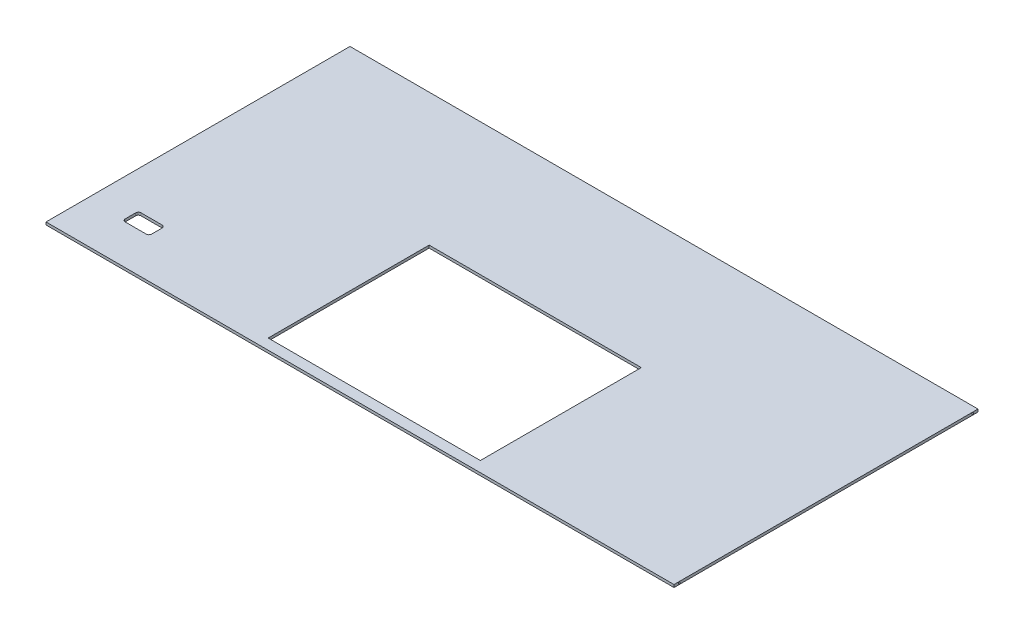
from build123d import *

# Parameters (mm, degrees)
SKETCH1_W           = 1190
SKETCH1_H           = 576
BOSS_EXTRUDE1_DEPTH = 5
SKETCH2_R           = 1.5
CUT_EXTRUDE1_DEPTH  = 10
SKETCH3_W           = 150
SKETCH3_H           = 150
CUT_EXTRUDE2_DEPTH  = 10
SKETCH4_W           = 402
SKETCH4_H           = 305
CUT_EXTRUDE3_DEPTH  = 6
CUT_EXTRUDE4_DEPTH  = 10


with BuildPart() as part:
    # Sketch1 → Boss-Extrude1 (new body)
    with BuildSketch(Plane(origin=(0, 0, 0), x_dir=(1, 0, 0), z_dir=(0, 1, 0))):
        Rectangle(SKETCH1_W, SKETCH1_H)
    extrude(amount=BOSS_EXTRUDE1_DEPTH)

    # Sketch2 → Cut-Extrude1 (cut)
    with BuildSketch(Plane(origin=(595, 0, 0), x_dir=(0, 0, -1), z_dir=(1, 0, 0))):
        with Locations((-278, 2.5)):
            Circle(SKETCH2_R)
        with Locations(Location((278, 2.5, 0), (0, 0, 180))):
            Circle(SKETCH2_R)
    cut_extrude1 = extrude(amount=-CUT_EXTRUDE1_DEPTH, mode=Mode.SUBTRACT)

    # Mirror1: Cut-Extrude1 across plane
    add(cut_extrude1.mirror(Plane(origin=(0, 0, 0), x_dir=(0, 0, 1), z_dir=(1, 0, 0))), mode=Mode.SUBTRACT)

    # Sketch3 → Cut-Extrude2 (cut)
    with BuildSketch(Plane(origin=(0, 5, 0), x_dir=(1, 0, 0), z_dir=(0, 1, 0))):
        with Locations((5, -143)):
            Rectangle(SKETCH3_W, SKETCH3_H)
    extrude(amount=-CUT_EXTRUDE2_DEPTH, mode=Mode.SUBTRACT)

    # Sketch4 → Cut-Extrude3 (cut)
    with BuildSketch(Plane(origin=(0, 5, 0), x_dir=(1, 0, 0), z_dir=(0, 1, 0))):
        with Locations((7, -115.5)):
            Rectangle(SKETCH4_W, SKETCH4_H)
    extrude(amount=-CUT_EXTRUDE3_DEPTH, mode=Mode.SUBTRACT)

    # Sketch5 → Cut-Extrude4 (cut)
    with BuildSketch(Plane(origin=(0, 5, 0), x_dir=(1, 0, 0), z_dir=(0, 1, 0))):
        with BuildLine():
            Line((-520, -183), (-480, -183))
            ThreePointArc((-480, -183), (-476.464466094, -184.464466094), (-475, -188))
            Line((-475, -188), (-475, -208))
            ThreePointArc((-475, -208), (-476.464466094, -211.535533906), (-480, -213))
            Line((-480, -213), (-520, -213))
            ThreePointArc((-520, -213), (-523.535533906, -211.535533906), (-525, -208))
            Line((-525, -208), (-525, -188))
            ThreePointArc((-525, -188), (-523.535533906, -184.464466094), (-520, -183))
        make_face()
    extrude(amount=-CUT_EXTRUDE4_DEPTH, mode=Mode.SUBTRACT)


solid = part.part
